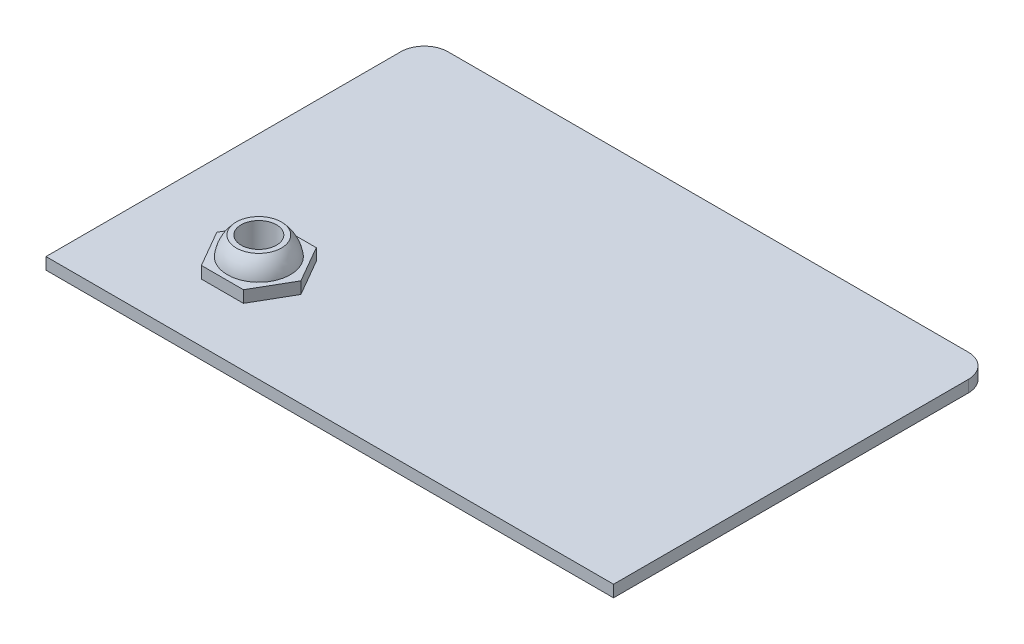
from build123d import *

# Parameters (mm, degrees)
EXTRUDE1_DEPTH = 3.175
EXTRUDE2_DEPTH = 3.175
SKETCH4_R      = 4.750719405
EXTRUDE3_DEPTH = 184.514359856


with BuildPart() as part:
    # Sketch1 → Extrude1 (new body)
    with BuildSketch(Plane(origin=(0, 0, 0), x_dir=(1, 0, 0), z_dir=(0, 1, 0))):
        with BuildLine():
            Line((0, 0), (152.4, 0))
            Line((152.4, 0), (152.4, 95.25))
            ThreePointArc((152.4, 95.25), (150.540128061, 99.740128061), (146.05, 101.6))
            Line((146.05, 101.6), (6.35, 101.6))
            ThreePointArc((6.35, 101.6), (1.859871939, 99.740128061), (0, 95.25))
            Line((0, 95.25), (0, 0))
        make_face()
    extrude(amount=-EXTRUDE1_DEPTH)

    # Sketch2 → Extrude2 (add)
    with BuildSketch(Plane(origin=(0, 0, 0), x_dir=(1, 0, 0), z_dir=(0, 1, 0))):
        Polygon((43.041816565, 25.4), (37.395908282, 35.179), (26.104091718, 35.179), (20.458183435, 25.4), (26.104091718, 15.621), (37.395908282, 15.621), align=None)
    extrude(amount=EXTRUDE2_DEPTH)

    # Sketch3 → Revolve1 (revolve)
    with BuildSketch(Plane.XY.offset(-25.4), mode=Mode.PRIVATE) as revolve1_sk:
        with BuildLine():
            Line((31.75, 8.191629817), (37.811630026, 8.191629817))
            ThreePointArc((37.811630026, 8.191629817), (39.423025401, 5.879728861), (40.214178276, 3.175))
            Line((40.214178276, 3.175), (31.75, 3.175))
            Line((31.75, 3.175), (31.75, 8.191629817))
        make_face()
    revolve(revolve1_sk.sketch.rotate(Axis((31.75, 3.175, -25.4), (0, 1, 0)), 270), axis=Axis((31.75, 3.175, -25.4), (0, 1, 0)))

    # Sketch4 → Extrude3 (cut, through all)
    with BuildSketch(Plane(origin=(0, 8.191629817, 0), x_dir=(-1, 0, 0), z_dir=(0, 1, 0))):
        with Locations(Location((-31.75, -25.4, 0), (0, 0, 90))):
            Circle(SKETCH4_R)
    extrude(amount=-EXTRUDE3_DEPTH, mode=Mode.SUBTRACT)


solid = part.part
